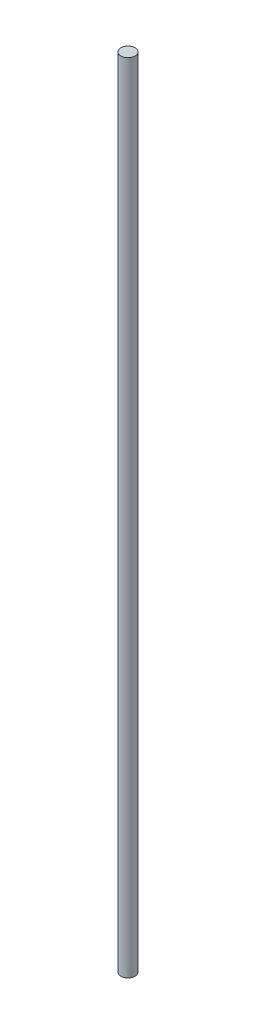
from build123d import *

# Parameters (mm, degrees)
SKETCH2_R           = 1.5
BOSS_EXTRUDE1_DEPTH = 167.2


with BuildPart() as part:
    # Sketch2 → Boss-Extrude1 (new body)
    with BuildSketch(Plane(origin=(0, 0, 0), x_dir=(1, 0, 0), z_dir=(0, 1, 0))):
        with Locations(Location((0, 0, 0), (0, 0, 270))):
            Circle(SKETCH2_R)
    extrude(amount=BOSS_EXTRUDE1_DEPTH)


solid = part.part
